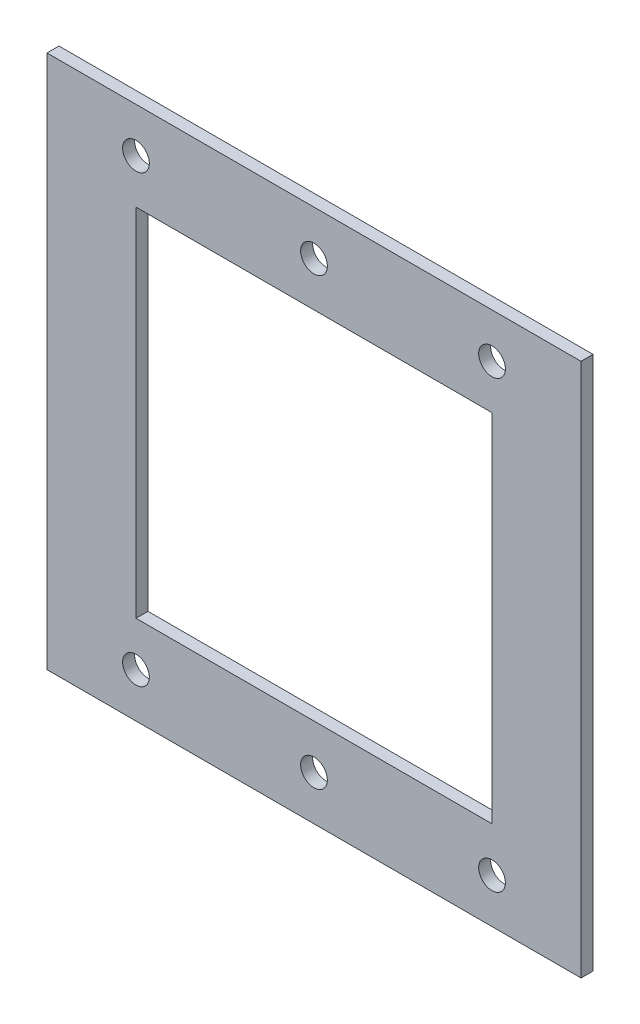
from build123d import *

# Parameters (mm, degrees)
CROQUIS1_W              = 120
CROQUIS1_H              = 120
CROQUIS1_R              = 3
CROQUIS1_W_2            = 80
CROQUIS1_H_2            = 80
SALIENTE_EXTRUIR1_DEPTH = 2.7


with BuildPart() as part:
    # Croquis1 → Saliente-Extruir1 (new body)
    with BuildSketch(Plane.XY):
        Rectangle(CROQUIS1_W, CROQUIS1_H)
        with Locations(Location((-40, 50, 0), (0, 0, 180))):
            Circle(CROQUIS1_R, mode=Mode.SUBTRACT)
        with Locations(Location((0, 50, 0), (0, 0, 180))):
            Circle(CROQUIS1_R, mode=Mode.SUBTRACT)
        with Locations(Location((40, 50, 0), (0, 0, 180))):
            Circle(CROQUIS1_R, mode=Mode.SUBTRACT)
        with Locations(Location((-40, -50, 0), (0, 0, 180))):
            Circle(CROQUIS1_R, mode=Mode.SUBTRACT)
        with Locations(Location((0, -50, 0), (0, 0, 180))):
            Circle(CROQUIS1_R, mode=Mode.SUBTRACT)
        with Locations(Location((40, -50, 0), (0, 0, 180))):
            Circle(CROQUIS1_R, mode=Mode.SUBTRACT)
        Rectangle(CROQUIS1_W_2, CROQUIS1_H_2, mode=Mode.SUBTRACT)
    extrude(amount=SALIENTE_EXTRUIR1_DEPTH)


solid = part.part
